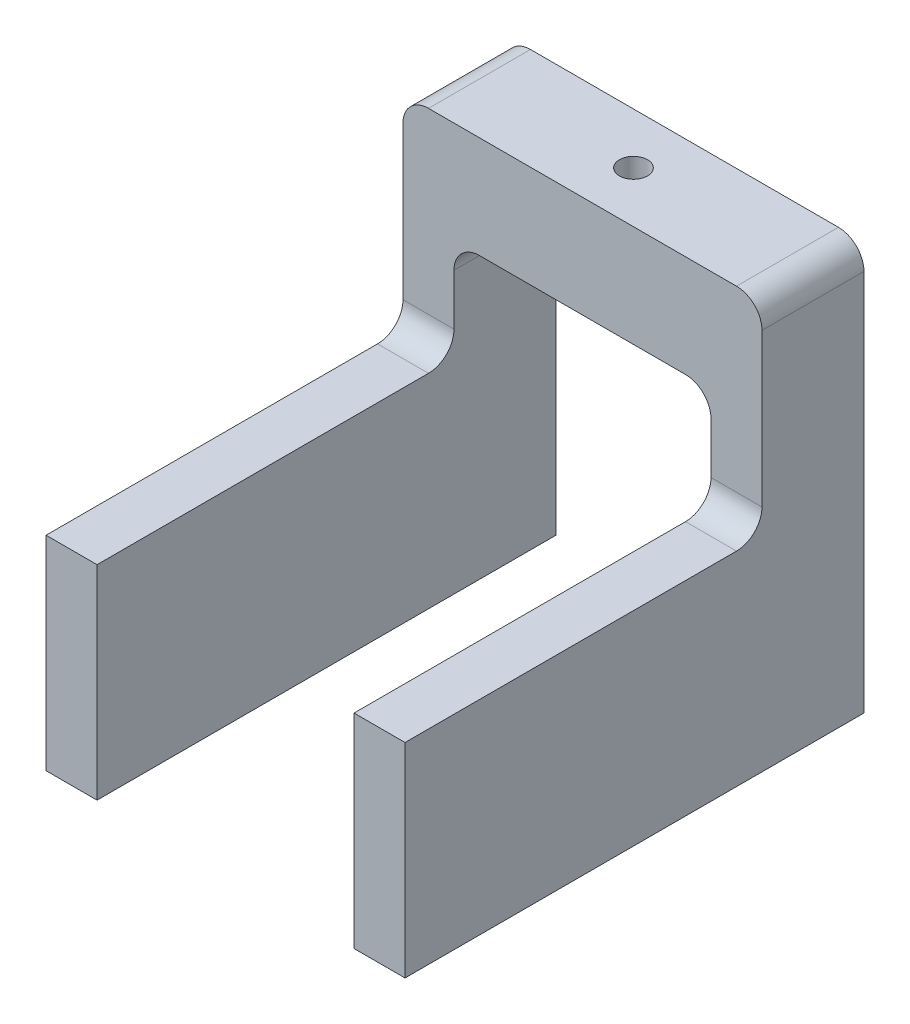
from build123d import *

# Parameters (mm, degrees)
BOSS_EXTRUDE1_DEPTH   = 89.408
SKETCH2_W             = 64.008
SKETCH2_H             = 76.2
CUT_EXTRUDE1_DEPTH    = 178.146381459
F_7_0MM_DOWEL_HOLE1_D = 7
FILLET1_R             = 6.35


with BuildPart() as part:
    # Sketch1 → Boss-Extrude1 (new body)
    with BuildSketch(Plane(origin=(0, 0, 0), x_dir=(0, 0, -1), z_dir=(1, 0, 0))):
        Polygon((0, 0), (-114.3, 0), (-114.3, 50.8), (-25.4, 50.8), (-25.4, 101.6), (0, 101.6), align=None)
    extrude(amount=BOSS_EXTRUDE1_DEPTH)

    # Sketch2 → Cut-Extrude1 (cut, through all)
    with BuildSketch(Plane(origin=(0, 0, 0), x_dir=(-1, 0, 0), z_dir=(0, 0, -1))):
        with Locations((-44.704, 38.1)):
            Rectangle(SKETCH2_W, SKETCH2_H)
    extrude(amount=-CUT_EXTRUDE1_DEPTH, mode=Mode.SUBTRACT)

    # Ø7.0mm Dowel Hole1 (through all)
    with Locations(Plane(origin=(0, 101.6, 0), x_dir=(1, 0, 0), z_dir=(0, 1, 0))):
        with Locations((44.704, -12.7)):
            Hole(F_7_0MM_DOWEL_HOLE1_D / 2)

    # Fillet1
    fillet1_edges = [part.edges().sort_by_distance(p)[0] for p in [
        (83.058, 50.8, 25.4),
        (6.35, 50.8, 25.4),
        (76.708, 76.2, 12.7),
        (12.7, 76.2, 12.7),
        (0, 101.6, 12.7),
        (89.408, 101.6, 12.7),
    ]]
    fillet(fillet1_edges, radius=FILLET1_R)


solid = part.part
